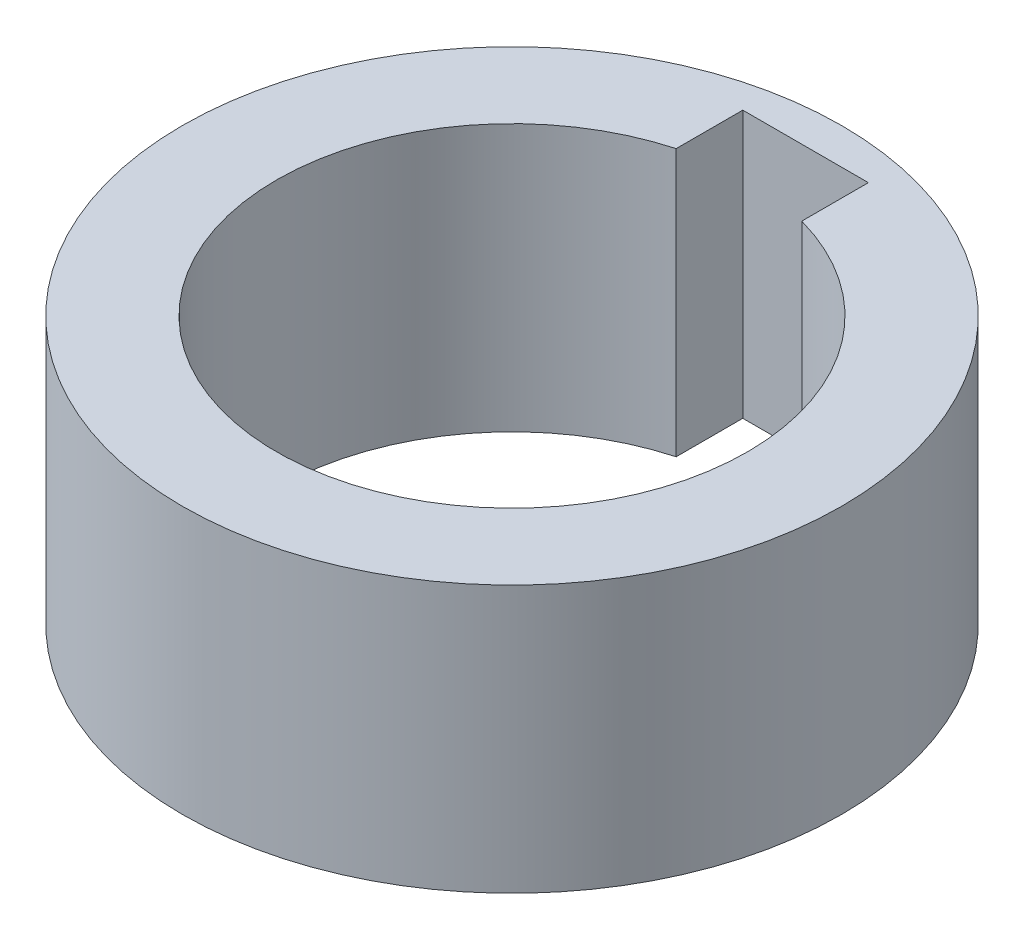
from build123d import *

# Parameters (mm, degrees)
SKETCH1_R           = 21
SKETCH1_R_2         = 15
BOSS_EXTRUDE1_DEPTH = 17
CUT_EXTRUDE1_DEPTH  = 35.219877265


with BuildPart() as part:
    # Sketch1 → Boss-Extrude1 (new body)
    with BuildSketch(Plane(origin=(0, 0, 0), x_dir=(1, 0, 0), z_dir=(0, 1, 0))):
        with Locations(Location((0, 0, 0), (0, 0, 270))):
            Circle(SKETCH1_R)
        with Locations(Location((0, 0, 0), (0, 0, 270))):
            Circle(SKETCH1_R_2, mode=Mode.SUBTRACT)
    extrude(amount=-BOSS_EXTRUDE1_DEPTH)

    # Sketch2 → Cut-Extrude1 (cut, through all)
    with BuildSketch(Plane(origin=(0, 0, 0), x_dir=(1, 0, 0), z_dir=(0, 1, 0))):
        with BuildLine():
            Line((4, 18.7), (-4, 18.7))
            Line((-4, 18.7), (-4, 14.456832295))
            ThreePointArc((-4, 14.456832295), (0, 15), (4, 14.456832295))
            Line((4, 14.456832295), (4, 18.7))
        make_face()
    extrude(amount=-CUT_EXTRUDE1_DEPTH, mode=Mode.SUBTRACT)


solid = part.part
